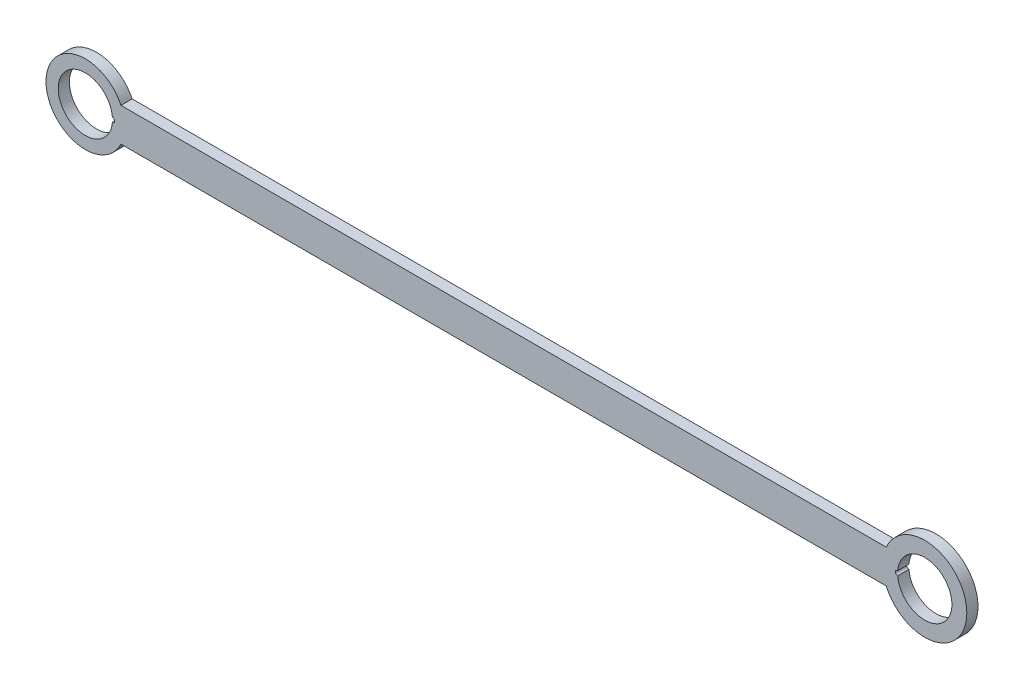
from build123d import *

# Parameters (mm, degrees)
SKETCH_1_R          = 9.7
EXTRUDE_1_DEPTH     = 4
SKETCH_3_R          = 0.8
CUT_EXTRUDE_1_DEPTH = 10


with BuildPart() as part:
    # 草图1 → 凸台-拉伸1 (new body)
    with BuildSketch(Plane.XY):
        with BuildLine():
            Line((12.718684308, 6), (286.224480753, 6))
            ThreePointArc((286.224480753, 6), (315.02547605, 0), (286.224480753, -6))
            Line((286.224480753, -6), (12.718684308, -6))
            ThreePointArc((12.718684308, -6), (-14.062891969, 0), (12.718684308, 6))
        make_face()
        Circle(SKETCH_1_R, mode=Mode.SUBTRACT)
        with Locations((300, 0)):
            Circle(SKETCH_1_R, mode=Mode.SUBTRACT)
    extrude(amount=EXTRUDE_1_DEPTH)

    # 草图3 → 切除-拉伸1 (cut)
    with BuildSketch(Plane.XY.offset(4)):
        with Locations((9.7, 0)):
            Circle(SKETCH_3_R)
        with Locations((290.3, 0)):
            Circle(SKETCH_3_R)
    extrude(amount=-CUT_EXTRUDE_1_DEPTH, mode=Mode.SUBTRACT)


solid = part.part
